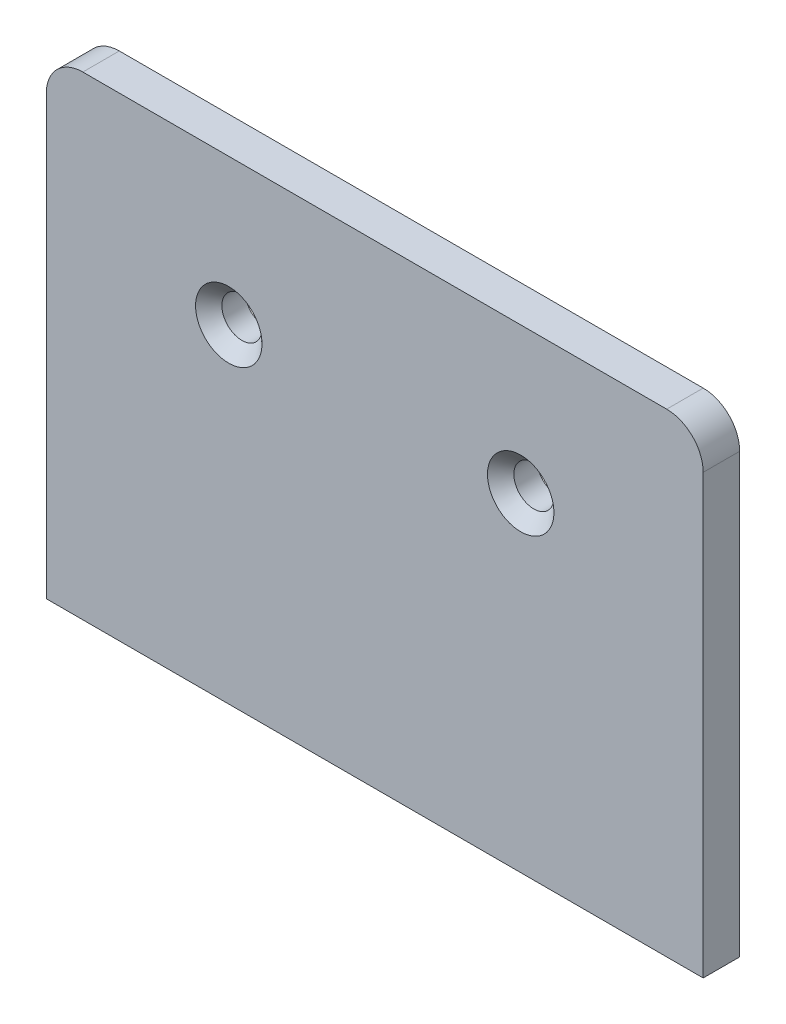
from build123d import *

# Parameters (mm, degrees)
SKETCH_1_W      = 90
SKETCH_1_H      = 65
EXTRUDE_1_DEPTH = 5
HOLE_WIZARD_1_D = 5.5
HOLE_WIZARD_2_D = 5.5
CHAMFER_1_SIZE  = 1.80208992
CHAMFER_2_SIZE  = 1.80208992
FILLET_1_R      = 5
FILLET_2_R      = 5


with BuildPart() as part:
    # 草图1 → 凸台-拉伸1 (new body)
    with BuildSketch(Plane(origin=(0, 0, 0), x_dir=(-1, 0, 0), z_dir=(0, 0, -1))):
        with Locations((0, 72.5)):
            Rectangle(SKETCH_1_W, SKETCH_1_H)
    extrude(amount=-EXTRUDE_1_DEPTH)

    # 孔1 (through all)
    with Locations(Plane.XY.offset(5)):
        with Locations((-20, 85)):
            Hole(HOLE_WIZARD_1_D / 2)

    # 孔2 (through all)
    with Locations(Plane.XY.offset(5)):
        with Locations((20, 85)):
            Hole(HOLE_WIZARD_2_D / 2)

    # 倒角1
    chamfer_1_edges = [part.edges().sort_by_distance(p)[0] for p in [
        (-17.25, 85, 5),
    ]]
    chamfer(chamfer_1_edges, length=CHAMFER_1_SIZE)

    # 倒角2
    chamfer_2_edges = [part.edges().sort_by_distance(p)[0] for p in [
        (22.75, 85, 5),
    ]]
    chamfer(chamfer_2_edges, length=CHAMFER_2_SIZE)

    # 圆角1
    fillet_1_edges = [part.edges().sort_by_distance(p)[0] for p in [
        (45, 105, 2.5),
    ]]
    fillet(fillet_1_edges, radius=FILLET_1_R)

    # 圆角2
    fillet_2_edges = [part.edges().sort_by_distance(p)[0] for p in [
        (-45, 105, 2.5),
    ]]
    fillet(fillet_2_edges, radius=FILLET_2_R)


solid = part.part
